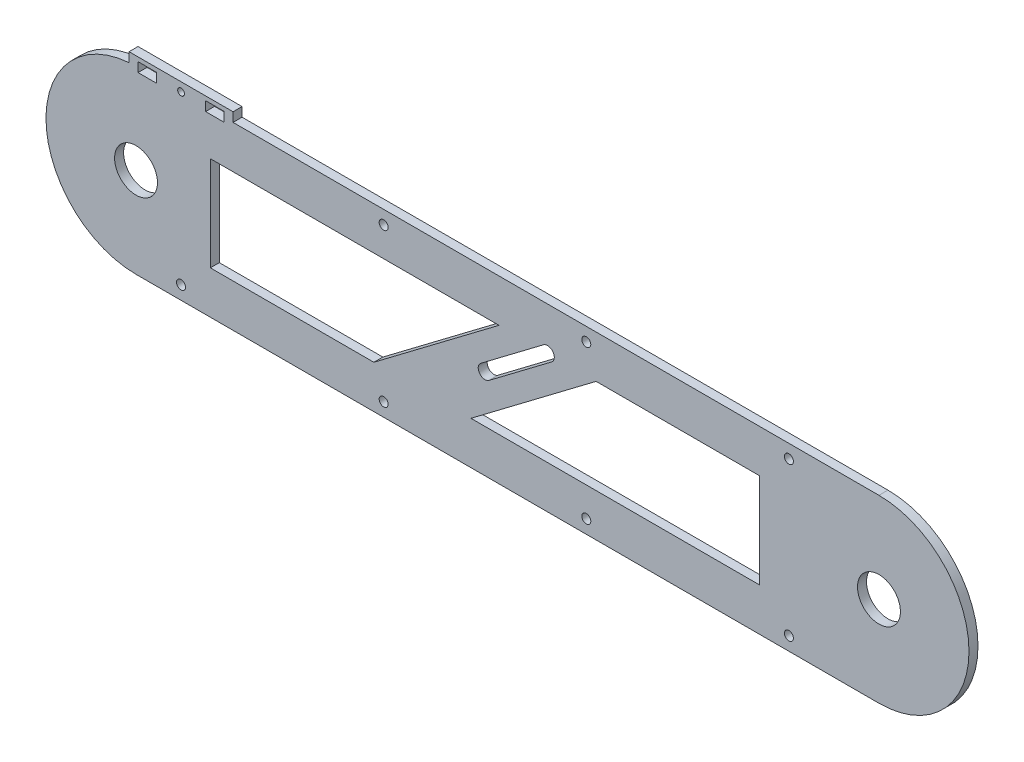
from build123d import *

# Parameters (mm, degrees)
SKETCH_1_R          = 9.53
EXTRUDE_1_DEPTH     = 4
SKETCH_4_W          = 46.2
SKETCH_4_H          = 8.602857229
EXTRUDE_2_DEPTH     = 4
SKETCH_2_R          = 2
SKETCH_2_R_2        = 1.5
SKETCH_2_W          = 8.2
SKETCH_2_H          = 4.2
CUT_EXTRUDE_1_DEPTH = 4
CUT_EXTRUDE_2_DEPTH = 10


with BuildPart() as part:
    # 草图1 → 凸台-拉伸1 (new body)
    with BuildSketch(Plane.XY):
        with BuildLine():
            Line((328.542857143, -40.145714286), (-1.457142857, -40.145714286))
            ThreePointArc((-1.457142857, -40.145714286), (-41.457142857, -0.145714286), (-1.457142857, 39.854285714))
            Line((-1.457142857, 39.854285714), (328.542857143, 39.854285714))
            ThreePointArc((328.542857143, 39.854285714), (368.542857143, -0.145714286), (328.542857143, -40.145714286))
        make_face()
        with Locations((-1.457142857, -0.145714286)):
            Circle(SKETCH_1_R, mode=Mode.SUBTRACT)
        with Locations((328.542857143, -0.145714286)):
            Circle(SKETCH_1_R, mode=Mode.SUBTRACT)
    extrude(amount=EXTRUDE_1_DEPTH)

    # 草图4 → 凸台-拉伸2 (add)
    with BuildSketch(Plane.XY.offset(4)):
        with Locations((18.542857143, 39.652857099)):
            Rectangle(SKETCH_4_W, SKETCH_4_H)
    extrude(amount=-EXTRUDE_2_DEPTH)

    # 草图2 → 切除-拉伸1 (cut)
    with BuildSketch(Plane.XY.offset(4)):
        with Locations((108.542857143, 33.854285714)):
            Circle(SKETCH_2_R)
        with Locations((198.542857143, 33.854285714)):
            Circle(SKETCH_2_R)
        with Locations((288.542857143, 33.854285714)):
            Circle(SKETCH_2_R)
        with Locations((108.542857143, -34.145714286)):
            Circle(SKETCH_2_R)
        with Locations((198.542857143, -34.145714286)):
            Circle(SKETCH_2_R)
        with Locations((288.542857143, -34.145714286)):
            Circle(SKETCH_2_R)
        with Locations((18.542857143, -34.145714286)):
            Circle(SKETCH_2_R)
        with Locations((18.542857143, 40.014285714)):
            Circle(SKETCH_2_R_2)
        Polygon((31.542857143, -21.145714286), (104.183898028, -21.145714286), (159.772133322, 20.854285714), (31.542857143, 20.854285714), align=None)
        Polygon((275.542857143, 20.854285714), (202.901816258, 20.854285714), (147.313580964, -21.145714286), (275.542857143, -21.145714286), align=None)
        with Locations((33.542857143, 40.014285714)):
            Rectangle(SKETCH_2_W, SKETCH_2_H)
        with Locations((3.542857143, 40.014285714)):
            Rectangle(SKETCH_2_W, SKETCH_2_H)
    extrude(amount=-CUT_EXTRUDE_1_DEPTH, mode=Mode.SUBTRACT)

    # 草图3 → 切除-拉伸2 (cut)
    with BuildSketch(Plane.XY.offset(4)):
        with BuildLine():
            Line((183.145474057, 18.460683743), (155.35135641, -2.539316257))
            ThreePointArc((155.35135641, -2.539316257), (151.149255171, -1.954213553), (151.734357875, 2.247887686))
            Line((151.734357875, 2.247887686), (179.528475522, 23.247887686))
            ThreePointArc((179.528475522, 23.247887686), (183.730576762, 22.662784982), (183.145474057, 18.460683743))
        make_face()
    extrude(amount=-CUT_EXTRUDE_2_DEPTH, mode=Mode.SUBTRACT)


solid = part.part
